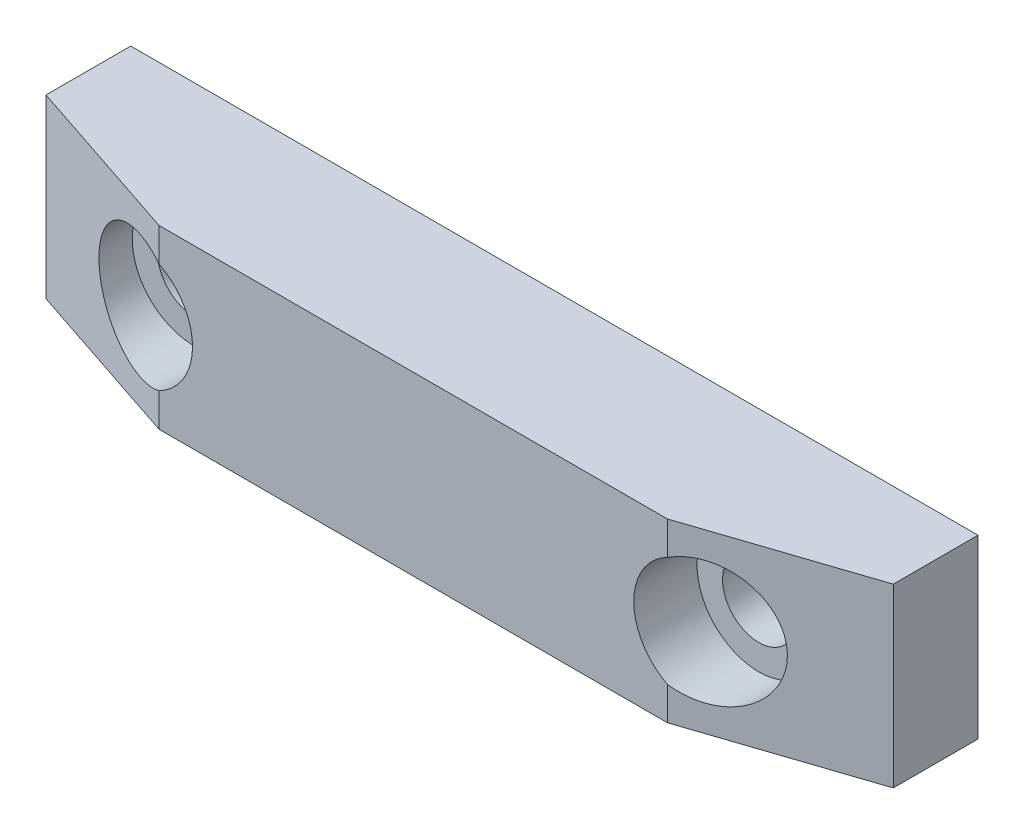
from build123d import *

# Parameters (mm, degrees)
SKETCH2_W                                      = 38.1
SKETCH2_H                                      = 6.35
BOSS_EXTRUDE2_DEPTH                            = 7.9375
CBORE_FOR_4_SOCKET_HEAD_CAP_SCREW1_D           = 3.2639
CBORE_FOR_4_SOCKET_HEAD_CAP_SCREW1_CBORE_D     = 5.55752
CBORE_FOR_4_SOCKET_HEAD_CAP_SCREW1_CBORE_DEPTH = 2.8448
CUT_EXTRUDE1_DEPTH                             = 12.7


with BuildPart() as part:
    # Sketch2 → Boss-Extrude2 (new body)
    with BuildSketch(Plane(origin=(0, 0, 0), x_dir=(1, 0, 0), z_dir=(0, 1, 0))):
        with Locations((19.05, 3.175)):
            Rectangle(SKETCH2_W, SKETCH2_H)
    extrude(amount=BOSS_EXTRUDE2_DEPTH)

    # CBORE for #4 Socket Head Cap Screw1 (through all)
    with Locations(Plane(origin=(6.35, 3.96875, 0), x_dir=(1, 0, 0), z_dir=(0, 0, 1))):
        with Locations((0, 0), (25.4, 0)):
            CounterBoreHole(CBORE_FOR_4_SOCKET_HEAD_CAP_SCREW1_D / 2, CBORE_FOR_4_SOCKET_HEAD_CAP_SCREW1_CBORE_D / 2, CBORE_FOR_4_SOCKET_HEAD_CAP_SCREW1_CBORE_DEPTH)

    # Sketch4 → Cut-Extrude1 (cut)
    with BuildSketch(Plane(origin=(0, 7.9375, 0), x_dir=(1, 0, 0), z_dir=(0, 1, 0))):
        Polygon((0, 0), (0, 2.54), (7.62, 0), align=None)
        Polygon((38.1, 2.54), (30.48, 0), (38.1, 0), align=None)
    extrude(amount=-CUT_EXTRUDE1_DEPTH, mode=Mode.SUBTRACT)


solid = part.part
